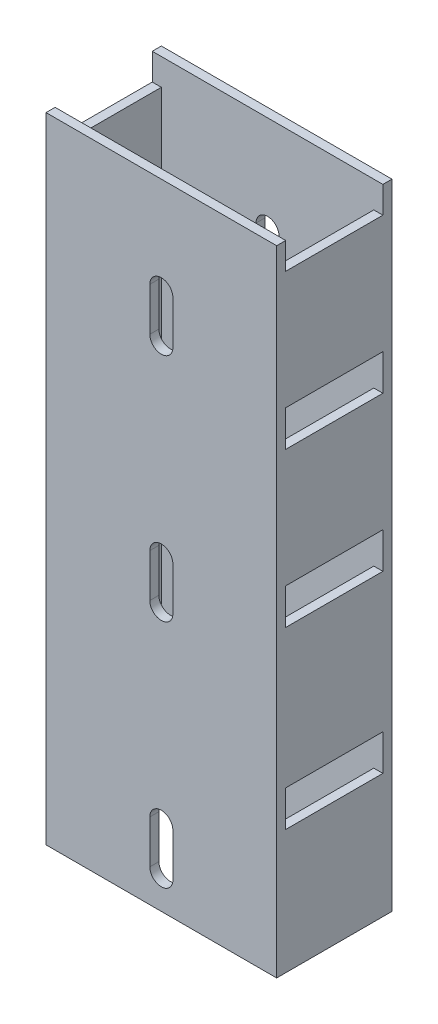
from build123d import *

# Parameters (mm, degrees)
SKETCH1_W           = 50.8
SKETCH1_H           = 25.4
SKETCH1_W_2         = 46.8
SKETCH1_H_2         = 21.4
BOSS_EXTRUDE1_DEPTH = 139.7
SKETCH2_W           = 21.4
SKETCH2_H           = 7.9375
CUT_EXTRUDE1_DEPTH  = 151.804144505
LPATTERN1_COUNT     = 3
LPATTERN1_PITCH     = 33.9725
LPATTERN1_COL_COUNT = 2
LPATTERN1_COL_PITCH = 38.5445
CUT_EXTRUDE2_DEPTH  = 151.804144505
LPATTERN2_COUNT     = 3
LPATTERN2_PITCH     = 50.8


with BuildPart() as part:
    # Sketch1 → Boss-Extrude1 (new body)
    with BuildSketch(Plane(origin=(0, 0, 0), x_dir=(1, 0, 0), z_dir=(0, 1, 0))):
        with Locations((25.4, 12.7)):
            Rectangle(SKETCH1_W, SKETCH1_H)
        with Locations((25.4, 12.7)):
            Rectangle(SKETCH1_W_2, SKETCH1_H_2, mode=Mode.SUBTRACT)
    extrude(amount=-BOSS_EXTRUDE1_DEPTH)

    # Sketch2 → Cut-Extrude1 (cut, through all)
    with BuildSketch(Plane(origin=(50.8, 0, 0), x_dir=(0, 0, -1), z_dir=(1, 0, 0))):
        with Locations((12.7, -69.85)):
            Rectangle(SKETCH2_W, SKETCH2_H)
    cut_extrude1 = extrude(amount=-CUT_EXTRUDE1_DEPTH, mode=Mode.SUBTRACT)

    # LPattern1: Cut-Extrude1 ×3
    with Locations(*[(0, i * LPATTERN1_PITCH, 0) for i in range(1, LPATTERN1_COUNT)]):
        add(cut_extrude1, mode=Mode.SUBTRACT)

    # LPattern1 col: Cut-Extrude1 ×2
    with Locations(*[(0, -i * LPATTERN1_COL_PITCH, 0) for i in range(1, LPATTERN1_COL_COUNT)]):
        add(cut_extrude1, mode=Mode.SUBTRACT)

    # Sketch3 → Cut-Extrude2 (cut, through all)
    with BuildSketch(Plane(origin=(0, 0, -25.4), x_dir=(-1, 0, 0), z_dir=(0, 0, -1))):
        with BuildLine():
            Line((-22.86, -21.336), (-22.86, -30.861))
            ThreePointArc((-22.86, -30.861), (-25.4, -33.401), (-27.94, -30.861))
            Line((-27.94, -30.861), (-27.94, -21.336))
            ThreePointArc((-27.94, -21.336), (-25.4, -18.796), (-22.86, -21.336))
        make_face()
    cut_extrude2 = extrude(amount=-CUT_EXTRUDE2_DEPTH, mode=Mode.SUBTRACT)

    # LPattern2: Cut-Extrude2 ×3
    with Locations(*[(0, -i * LPATTERN2_PITCH, 0) for i in range(1, LPATTERN2_COUNT)]):
        add(cut_extrude2, mode=Mode.SUBTRACT)


solid = part.part
